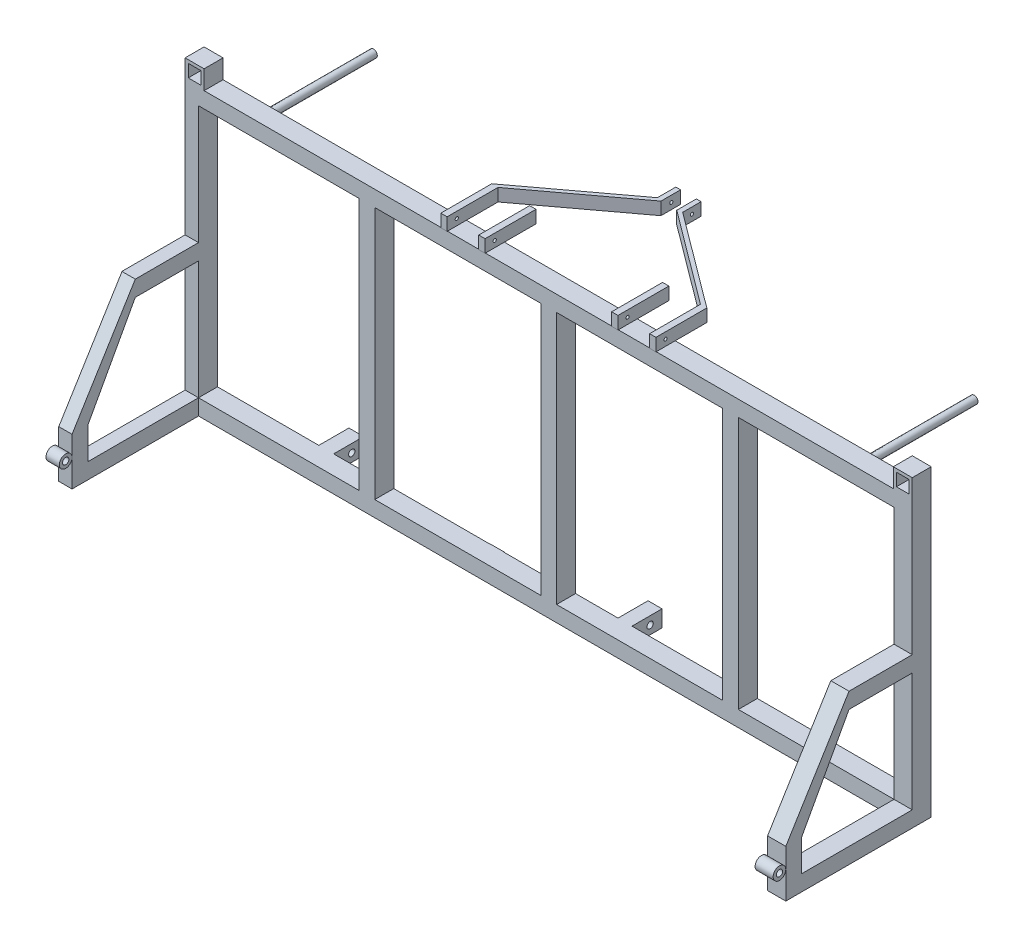
from build123d import *

# Parameters (mm, degrees)
SKETCH1_W                = 2300
SKETCH1_H                = 900
SKETCH1_W_2              = 525
SKETCH1_H_2              = 800
SKETCH1_W_3              = 492.389580631
SKETCH1_W_4              = 507.610419369
BOSS_EXTRUDE1_DEPTH      = 60
SKETCH2_W                = 42.389580631
SKETCH2_H                = 50
SKETCH2_W_2              = 57.610419369
BOSS_EXTRUDE2_DEPTH      = 1
SKETCH4_W                = 50
SKETCH4_H                = 50.463593603
BOSS_EXTRUDE4_DEPTH      = 1
SKETCH5_W                = 44.216514846
SKETCH5_H                = 50
BOSS_EXTRUDE5_DEPTH      = 1
SKETCH6_W                = 42.447812038
SKETCH6_H                = 50
BOSS_EXTRUDE6_DEPTH      = 1
BOSS_EXTRUDE7_DEPTH      = 1
BOSS_EXTRUDE9_DEPTH      = 100
BOSS_EXTRUDE9_DEPTH_BACK = 61
SKETCH8_W                = 20
SKETCH8_H                = 40
SKETCH9_R                = 5
CUT_EXTRUDE1_DEPTH       = 810
BOSS_EXTRUDE10_DEPTH     = 40
SKETCH12_R               = 5
CUT_EXTRUDE2_DEPTH       = 179
SKETCH13_W               = 44.216514846
SKETCH13_H               = 52.385988297
SKETCH13_W_2             = 46.77052042
SKETCH13_H_2             = 51.925334434
BOSS_EXTRUDE12_DEPTH     = 95
SKETCH14_R               = 10
CUT_EXTRUDE3_DEPTH       = 1270
BOSS_EXTRUDE13_START     = -60
SKETCH15_W               = 60
SKETCH15_H               = 60
SKETCH15_W_2             = 40
SKETCH15_H_2             = 40
BOSS_EXTRUDE13_DEPTH     = 60
SKETCH16_R               = 12
BOSS_EXTRUDE14_DEPTH     = 336
SKETCH17_W               = 42.389580631
SKETCH17_H               = 50
SKETCH17_W_2             = 57.610419369
BOSS_EXTRUDE15_DEPTH     = 400
SKETCH18_W               = 42.389580631
SKETCH18_H               = 50
SKETCH18_W_2             = 57.610419369
BOSS_EXTRUDE16_DEPTH     = 200
SKETCH19_W               = 50
SKETCH19_H               = 100
BOSS_EXTRUDE17_DEPTH     = 42.38958
BOSS_EXTRUDE18_DEPTH     = 42
BOSS_EXTRUDE19_START     = -57.610419
BOSS_EXTRUDE19_DEPTH     = 57.610419
SKETCH25_R               = 20
SKETCH25_R_2             = 10
BOSS_EXTRUDE20_DEPTH     = 42.389581
SKETCH26_R               = 20
SKETCH26_R_2             = 10
BOSS_EXTRUDE21_DEPTH     = 57


with BuildPart() as part:
    # Sketch1 → Boss-Extrude1 (new body)
    with BuildSketch(Plane.XY):
        Rectangle(SKETCH1_W, SKETCH1_H)
        with Locations((-287.5, 0)):
            Rectangle(SKETCH1_W_2, SKETCH1_H_2, mode=Mode.SUBTRACT)
        with Locations((287.5, 0)):
            Rectangle(SKETCH1_W_2, SKETCH1_H_2, mode=Mode.SUBTRACT)
        with Locations((846.194790316, 0)):
            Rectangle(SKETCH1_W_3, SKETCH1_H_2, mode=Mode.SUBTRACT)
        with Locations((-853.805209685, 0)):
            Rectangle(SKETCH1_W_4, SKETCH1_H_2, mode=Mode.SUBTRACT)
    extrude(amount=BOSS_EXTRUDE1_DEPTH)

    # Sketch2 → Boss-Extrude2 (add)
    with BuildSketch(Plane.XY.offset(60)):
        with Locations((-1128.805209684, -425)):
            Rectangle(SKETCH2_W, SKETCH2_H)
        with Locations((1121.194790316, -425)):
            Rectangle(SKETCH2_W_2, SKETCH2_H)
    extrude(amount=BOSS_EXTRUDE2_DEPTH)

    # Sketch4 → Boss-Extrude4 (add)
    with BuildSketch(Plane(origin=(0, 0, 0), x_dir=(-1, 0, 0), z_dir=(0, 0, -1))):
        with Locations((0, -425.231796802)):
            Rectangle(SKETCH4_W, SKETCH4_H)
    extrude(amount=BOSS_EXTRUDE4_DEPTH)

    # Sketch5 → Boss-Extrude5 (add)
    with BuildSketch(Plane(origin=(0, 0, 0), x_dir=(-1, 0, 0), z_dir=(0, 0, -1))):
        with Locations((-181.41, -425)):
            Rectangle(SKETCH5_W, SKETCH5_H)
    extrude(amount=BOSS_EXTRUDE5_DEPTH)

    # Sketch6 → Boss-Extrude6 (add)
    with BuildSketch(Plane(origin=(0, 0, 0), x_dir=(-1, 0, 0), z_dir=(0, 0, -1))):
        with Locations((223.59, -425)):
            Rectangle(SKETCH6_W, SKETCH6_H)
    extrude(amount=BOSS_EXTRUDE6_DEPTH)

    # Sketch7 → Boss-Extrude7 (add)
    with BuildSketch(Plane(origin=(0, 0, 0), x_dir=(-1, 0, 0), z_dir=(0, 0, -1))):
        Polygon((740.20473979, -400), (763.59, -400), (786.97526021, -400), (786.97526021, -450), (763.59, -450), (740.20473979, -450), align=None)
    extrude(amount=BOSS_EXTRUDE7_DEPTH)

    # Sketch8 → Boss-Extrude9 (add, two sides: drawn at the far end of the back side and taken through both)
    with BuildSketch(Plane(origin=(0, 0, 0), x_dir=(-1, 0, 0), z_dir=(0, 0, -1)).offset(-BOSS_EXTRUDE9_DEPTH_BACK)):
        with Locations((-330.2, 470)):
            Rectangle(SKETCH8_W, SKETCH8_H)
        with Locations((210.2, 470)):
            Rectangle(SKETCH8_W, SKETCH8_H)
        with Locations((330.2, 470)):
            Rectangle(SKETCH8_W, SKETCH8_H)
        with Locations((-210.2, 470)):
            Rectangle(SKETCH8_W, SKETCH8_H)
    extrude(amount=BOSS_EXTRUDE9_DEPTH + BOSS_EXTRUDE9_DEPTH_BACK)

    # Sketch9 → Cut-Extrude1 (cut)
    with BuildSketch(Plane(origin=(340.2, 0, 0), x_dir=(0, 0, -1), z_dir=(1, 0, 0))):
        with Locations((-30.5, 469.747568446)):
            Circle(SKETCH9_R)
    extrude(amount=-CUT_EXTRUDE1_DEPTH, mode=Mode.SUBTRACT)

    # Sketch11 → Boss-Extrude10 (add)
    with BuildSketch(Plane(origin=(0, 490, 0), x_dir=(1, 0, 0), z_dir=(0, 1, 0))):
        Polygon((340.2, 100), (40, 323.82798103), (40, 351.1), (40, 382.1), (25, 382.1), (25, 351.1), (25, 320.1), (320.2, 100), align=None)
        Polygon((-25, 351.1), (-25, 320.1), (-320.2, 100), (-340.2, 100), (-40, 323.82798103), (-40, 351.1), (-40, 382.1), (-25, 382.1), align=None)
    extrude(amount=-BOSS_EXTRUDE10_DEPTH)

    # Sketch12 → Cut-Extrude2 (cut)
    with BuildSketch(Plane.ZY.offset(40)):
        with Locations((-352.963990515, 470)):
            Circle(SKETCH12_R)
    extrude(amount=-CUT_EXTRUDE2_DEPTH, mode=Mode.SUBTRACT)

    # Sketch13 → Boss-Extrude12 (add)
    with BuildSketch(Plane(origin=(0, 0, 0), x_dir=(-1, 0, 0), z_dir=(0, 0, -1))):
        with Locations((-181.41, -426.192994149)):
            Rectangle(SKETCH13_W, SKETCH13_H)
        with Locations((763.59, -425.962667217)):
            Rectangle(SKETCH13_W_2, SKETCH13_H_2)
    extrude(amount=BOSS_EXTRUDE12_DEPTH)

    # Sketch14 → Cut-Extrude3 (cut)
    with BuildSketch(Plane.ZY.offset(786.97526021)):
        with Locations((-57.323954471, -425.962667217)):
            Circle(SKETCH14_R)
    extrude(amount=-CUT_EXTRUDE3_DEPTH, mode=Mode.SUBTRACT)

    # Sketch15 → Boss-Extrude13 (add)
    # profile 1 of 2: a face of its own
    with BuildSketch(Plane.XY.offset(60).offset(BOSS_EXTRUDE13_START)):
        with Locations((-1120, 480)):
            Rectangle(SKETCH15_W, SKETCH15_H)
        with Locations((-1120, 480)):
            Rectangle(SKETCH15_W_2, SKETCH15_H_2, mode=Mode.SUBTRACT)
    # profile 2 of 2: a face of its own
    with BuildSketch(Plane.XY.offset(60).offset(BOSS_EXTRUDE13_START)):
        with Locations((1120, 480)):
            Rectangle(SKETCH15_W, SKETCH15_H)
        with Locations((1120, 480)):
            Rectangle(SKETCH15_W_2, SKETCH15_H_2, mode=Mode.SUBTRACT)
    extrude(amount=BOSS_EXTRUDE13_DEPTH)

    # Sketch16 → Boss-Extrude14 (add)
    with BuildSketch(Plane(origin=(0, 0, 0), x_dir=(-1, 0, 0), z_dir=(0, 0, -1))):
        with Locations((-950, 425.8681938)):
            Circle(SKETCH16_R)
        with Locations((950, 423.991053502)):
            Circle(SKETCH16_R)
    extrude(amount=BOSS_EXTRUDE14_DEPTH)

    # Sketch17 → Boss-Extrude15 (add)
    with BuildSketch(Plane.XY.offset(60)):
        with Locations((-1128.805209684, -425)):
            Rectangle(SKETCH17_W, SKETCH17_H)
        with Locations((1121.194790316, -425)):
            Rectangle(SKETCH17_W_2, SKETCH17_H)
    extrude(amount=BOSS_EXTRUDE15_DEPTH)

    # Sketch18 → Boss-Extrude16 (add)
    with BuildSketch(Plane.XY.offset(60)):
        with Locations((-1128.805209684, 0)):
            Rectangle(SKETCH18_W, SKETCH18_H)
        with Locations((1121.194790316, 0)):
            Rectangle(SKETCH18_W_2, SKETCH18_H)
    extrude(amount=BOSS_EXTRUDE16_DEPTH)

    # Sketch19 → Boss-Extrude17 (add)
    with BuildSketch(Plane.ZY.offset(1150)):
        with Locations((435, -350)):
            Rectangle(SKETCH19_W, SKETCH19_H)
    extrude(amount=-BOSS_EXTRUDE17_DEPTH)

    # Sketch20 → Boss-Extrude18 (add)
    with BuildSketch(Plane(origin=(-1107.610419369, 0, 0), x_dir=(0, 0, -1), z_dir=(1, 0, 0))):
        Polygon((-260, -25), (-410, -300), (-460, -300), (-260, 25), align=None)
    extrude(amount=-BOSS_EXTRUDE18_DEPTH)

    # Sketch22 → Boss-Extrude19 (add)
    with BuildSketch(Plane(origin=(1150, 0, 0), x_dir=(0, 0, -1), z_dir=(1, 0, 0)).offset(BOSS_EXTRUDE19_START)):
        Polygon((-460, -300), (-260, 25), (-260, -25), (-410, -300), (-410, -400), (-460, -400), align=None)
    extrude(amount=BOSS_EXTRUDE19_DEPTH)


with BuildPart() as body_2:
    # Sketch25 → Boss-Extrude20 (new body)
    with BuildSketch(Plane.ZY.offset(1150)):
        with Locations((480, -363.381052549)):
            Circle(SKETCH25_R)
        with Locations((480, -363.381052549)):
            Circle(SKETCH25_R_2, mode=Mode.SUBTRACT)
    extrude(amount=-BOSS_EXTRUDE20_DEPTH)


with BuildPart() as body_3:
    # Sketch26 → Boss-Extrude21 (new body)
    with BuildSketch(Plane(origin=(1150, 0, 0), x_dir=(0, 0, -1), z_dir=(1, 0, 0))):
        with Locations((-480, -363.381052549)):
            Circle(SKETCH26_R)
        with Locations((-480, -363.381052549)):
            Circle(SKETCH26_R_2, mode=Mode.SUBTRACT)
    extrude(amount=-BOSS_EXTRUDE21_DEPTH)


solid = Compound([part.part, body_2.part, body_3.part])
